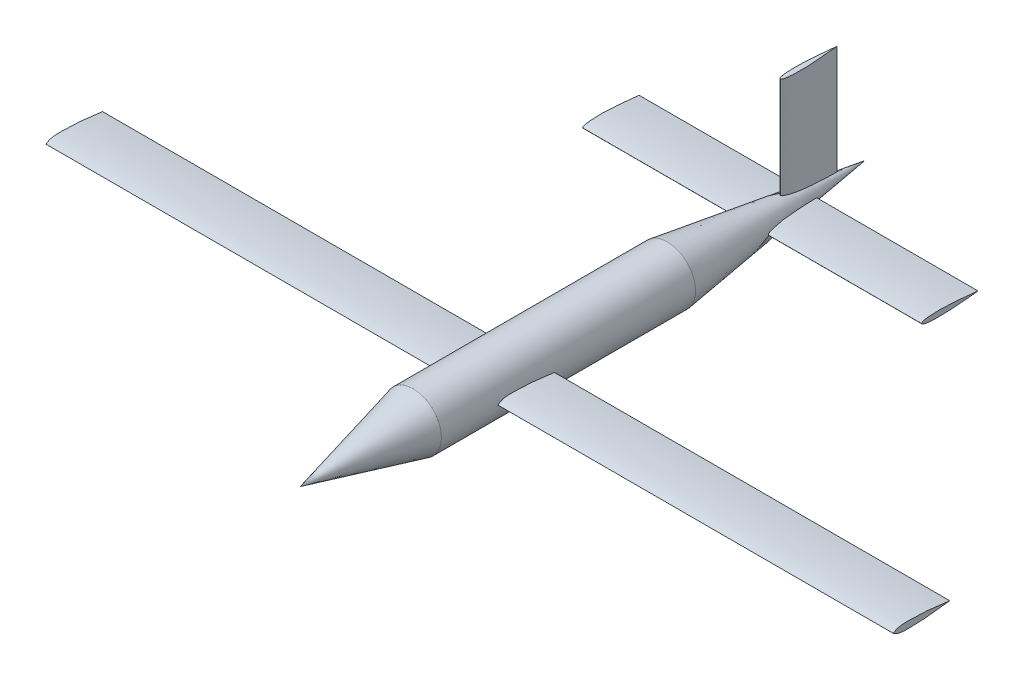
from build123d import *

# Parameters (mm, degrees)
EXTRUDE1_DEPTH = 190.5
EXTRUDE2_DEPTH = 76.2
EXTRUDE3_DEPTH = 50.8


with BuildPart() as part:
    # Sketch1 → Revolve1 (revolve)
    with BuildSketch(Plane(origin=(0, 0, 0), x_dir=(0, 0, -1), z_dir=(1, 0, 0)), mode=Mode.PRIVATE) as revolve1_sk:
        Polygon((0, 0), (50.8, 12.7), (165.1, 12.7), (254, 0), align=None)
    revolve(revolve1_sk.sketch.rotate(Axis((0, 0, 0), (0, 0, -1)), 90), axis=Axis((0, 0, 0), (0, 0, -1)))

    # Sketch3 → Extrude1 (add)
    with BuildSketch(Plane(origin=(0, 0, 0), x_dir=(0, 0, -1), z_dir=(1, 0, 0))):
        with BuildLine():
            add(Edge.make_bspline(
                [(76.2, 0), (78.052159442, 1.441388526), (82.492300095, 1.565159008), (91.022646999, 1.364672532), (97.396940241, 0.58481774), (101.6, 0)],
                knots=[0, 0, 0, 0, 0.257362768, 0.504009641, 1, 1, 1, 1], degree=3))
            add(Edge.make_bspline(
                [(76.2, 0), (78.052159442, -1.441388526), (82.492300095, -1.565159008), (91.022646999, -1.364672532), (97.396940241, -0.58481774), (101.6, 0)],
                knots=[0, 0, 0, 0, 0.257362768, 0.504009641, 1, 1, 1, 1], degree=3))
        make_face()
    extrude1 = extrude(amount=EXTRUDE1_DEPTH)

    # Sketch4 → Extrude2 (add)
    with BuildSketch(Plane(origin=(0, 0, 0), x_dir=(0, 0, -1), z_dir=(1, 0, 0))):
        with BuildLine():
            add(Edge.make_bspline(
                [(203.2, 0), (203.470224242, 0.499171466), (204.730226639, 1.007386607), (211.512528535, 1.400135326), (214.205468971, 1.225550995), (217.268535103, 1.03647005), (222.488286211, 0.690340741), (226.522382096, 0.271275288), (228.6, 0)],
                knots=[0, 0, 0, 0, 0.161459634, 0.275608032, 0.523304883, 0.574051287, 0.783072071, 1, 1, 1, 1], degree=3))
            add(Edge.make_bspline(
                [(203.2, 0), (203.470224242, -0.499171466), (204.730226639, -1.007386607), (211.512528535, -1.400135326), (214.205468971, -1.225550995), (217.268535103, -1.03647005), (222.488286211, -0.690340741), (226.522382096, -0.271275288), (228.6, 0)],
                knots=[0, 0, 0, 0, 0.161459634, 0.275608032, 0.523304883, 0.574051287, 0.783072071, 1, 1, 1, 1], degree=3))
        make_face()
    extrude2 = extrude(amount=EXTRUDE2_DEPTH)

    # Mirror1: Extrude1, Extrude2 across plane
    add(extrude1.mirror(Plane(origin=(0, 0, 0), x_dir=(0, 0, 1), z_dir=(1, 0, 0))))
    add(extrude2.mirror(Plane(origin=(0, 0, 0), x_dir=(0, 0, 1), z_dir=(1, 0, 0))))

    # Sketch5 → Extrude3 (add)
    with BuildSketch(Plane(origin=(0, 0, 0), x_dir=(1, 0, 0), z_dir=(0, 1, 0))):
        with BuildLine():
            add(Edge.make_bspline(
                [(0, 215.9), (0.674195579, 216.02990195), (0.921268663, 217.917359087), (1.363591407, 221.250082358), (1.171022605, 228.281015143), (1.012871609, 229.441552148), (0.631800849, 236.21249206), (0.458433851, 237.04445111), (0, 241.3)],
                knots=[0, 0, 0, 0, 0.195889449, 0.329618432, 0.465586727, 0.508661076, 0.76036192, 1, 1, 1, 1], degree=3))
            add(Edge.make_bspline(
                [(0, 215.9), (-0.674195579, 216.02990195), (-0.921268663, 217.917359087), (-1.363591407, 221.250082358), (-1.171022605, 228.281015143), (-1.012871609, 229.441552148), (-0.631800849, 236.21249206), (-0.458433851, 237.04445111), (0, 241.3)],
                knots=[0, 0, 0, 0, 0.195889449, 0.329618432, 0.465586727, 0.508661076, 0.76036192, 1, 1, 1, 1], degree=3))
        make_face()
    extrude(amount=EXTRUDE3_DEPTH)


solid = part.part
